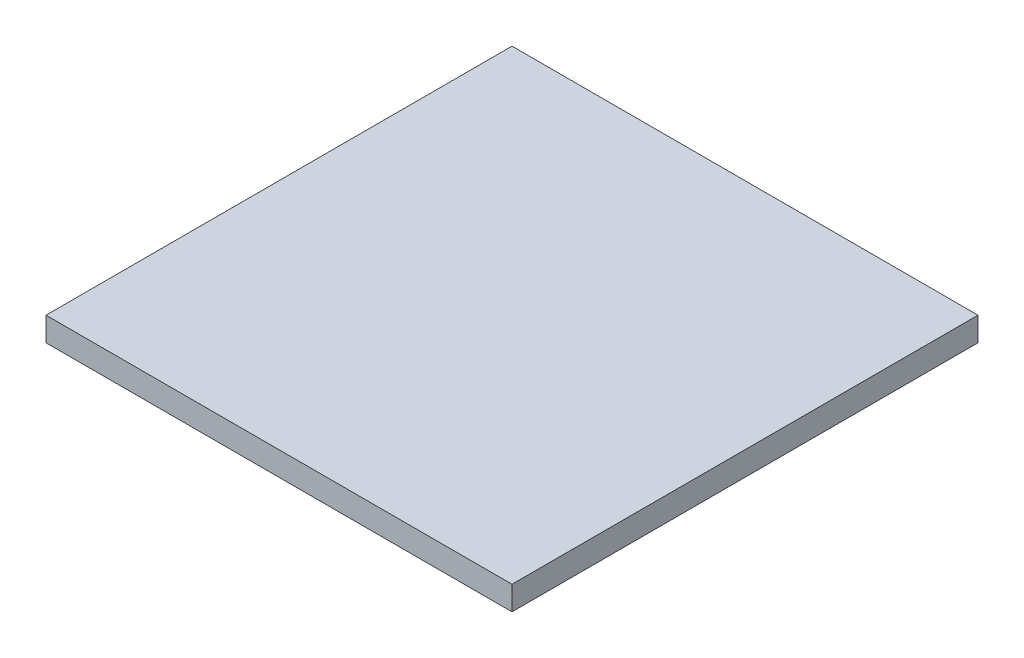
from build123d import *

# Parameters (mm, degrees)
SKETCH1_W           = 355.6
SKETCH1_H           = 355.6
BOSS_EXTRUDE1_DEPTH = 18.25625


with BuildPart() as part:
    # Sketch1 → Boss-Extrude1 (new body)
    with BuildSketch(Plane(origin=(0, 0, 0), x_dir=(1, 0, 0), z_dir=(0, 1, 0))):
        Rectangle(SKETCH1_W, SKETCH1_H)
    extrude(amount=BOSS_EXTRUDE1_DEPTH)


solid = part.part
